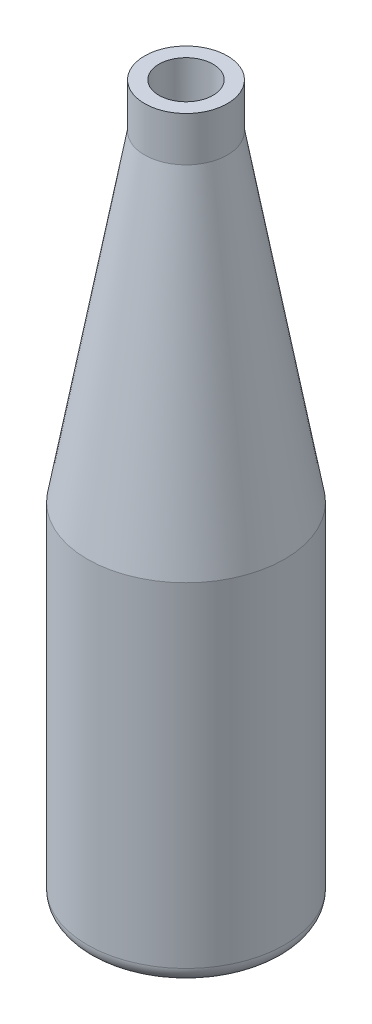
from build123d import *


with BuildPart() as part:
    # Schizzo1 → Rivoluzione1 (revolve)
    with BuildSketch(Plane.XY):
        with BuildLine():
            Line((0, 0), (-26, 0))
            ThreePointArc((-26, 0), (-29.535533906, 1.464466094), (-31, 5))
            Line((-31, 5), (-31, 110))
            Line((-31, 110), (-13, 211))
            Line((-13, 211), (-13, 225))
            Line((-13, 225), (-8.5, 225))
            Line((-8.5, 225), (-8.5, 220.5))
            Line((-8.5, 220.5), (-8.5, 210.602144339))
            Line((-8.5, 210.602144339), (-26.5, 109.602144339))
            Line((-26.5, 109.602144339), (-26.5, 5))
            ThreePointArc((-26.5, 5), (-26.353553391, 4.646446609), (-26, 4.5))
            Line((-26, 4.5), (-4.5, 4.5))
            Line((-4.5, 4.5), (0, 4.5))
            Line((0, 4.5), (0, 0))
        make_face()
    revolve(axis=Axis((0, 225, 0), (0, -1, 0)))


solid = part.part
